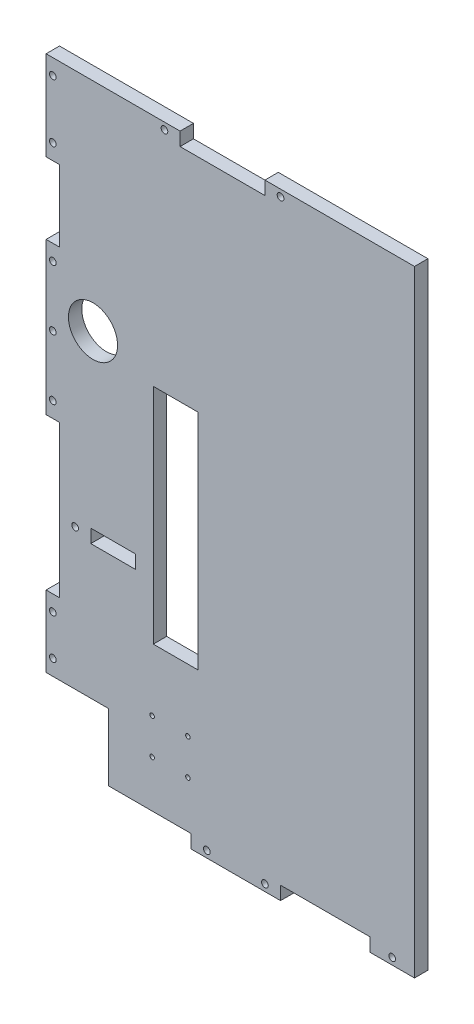
from build123d import *

# Parameters (mm, degrees)
ESQUISSE1_W             = 165
ESQUISSE1_H             = 276
BOSS_EXTRU_1_DEPTH      = 6
ESQUISSE2_W             = 38
ESQUISSE2_H             = 6
ESQUISSE2_W_2           = 6
ESQUISSE2_H_2           = 32
ESQUISSE2_H_3           = 68
ESQUISSE2_W_3           = 40
EXTERIEUR_DEPTH         = 10
ESQUISSE3_R             = 11
ESQUISSE3_W             = 20
ESQUISSE3_H             = 6
ENL_V_MAT_EXTRU_2_DEPTH = 322.616230934
ESQUISSE4_R             = 1.5
ESQUISSE4_R_2           = 1.005
ENL_V_MAT_EXTRU_3_DEPTH = 322.616230934
ESQUISSE5_R             = 2.995
ESQUISSE5_R_2           = 3
ESQUISSE5_R_3           = 2
ENL_V_MAT_EXTRU_4_DEPTH = 3
ESQUISSE6_W             = 20
ESQUISSE6_H             = 100
ENL_V_MAT_EXTRU_5_DEPTH = 322.616230934


with BuildPart() as part:
    # Esquisse1 → Boss.-Extru.1 (new body)
    with BuildSketch(Plane.XY):
        with Locations((-82.5, 138)):
            Rectangle(ESQUISSE1_W, ESQUISSE1_H)
    extrude(amount=BOSS_EXTRU_1_DEPTH)

    # Esquisse2 → exterieur (cut)
    with BuildSketch(Plane.XY.offset(6)):
        with Locations((-86, 273)):
            Rectangle(ESQUISSE2_W, ESQUISSE2_H)
        with Locations((-162, 220)):
            Rectangle(ESQUISSE2_W_2, ESQUISSE2_H_2)
        with Locations((-162, 102)):
            Rectangle(ESQUISSE2_W_2, ESQUISSE2_H_3)
        Polygon((-137, 36), (-137, 6), (-100, 6), (-100, 0), (-165, 0), (-165, 36), align=None)
        with Locations((-40, 3)):
            Rectangle(ESQUISSE2_W_3, ESQUISSE2_H)
    extrude(amount=-EXTERIEUR_DEPTH, mode=Mode.SUBTRACT)

    # Esquisse3 → Enlèv. mat.-Extru.2 (cut, through all)
    with BuildSketch(Plane.XY.offset(6)):
        with Locations((-144, 178.92)):
            Circle(ESQUISSE3_R)
        with Locations((-135, 99)):
            Rectangle(ESQUISSE3_W, ESQUISSE3_H)
    extrude(amount=-ENL_V_MAT_EXTRU_2_DEPTH, mode=Mode.SUBTRACT)

    # Esquisse4 → Enlèv. mat.-Extru.3 (cut, through all)
    with BuildSketch(Plane.XY.offset(6)):
        with Locations((-60, 273)):
            Circle(ESQUISSE4_R)
        with Locations((-112, 273)):
            Circle(ESQUISSE4_R)
        with Locations((-162, 197)):
            Circle(ESQUISSE4_R)
        with Locations((-162, 170)):
            Circle(ESQUISSE4_R)
        with Locations((-162, 143)):
            Circle(ESQUISSE4_R)
        with Locations((-162, 61)):
            Circle(ESQUISSE4_R)
        with Locations((-162, 43)):
            Circle(ESQUISSE4_R)
        with Locations((-93, 3)):
            Circle(ESQUISSE4_R)
        with Locations((-67, 3)):
            Circle(ESQUISSE4_R)
        with Locations((-10, 3)):
            Circle(ESQUISSE4_R)
        with Locations((-162, 269)):
            Circle(ESQUISSE4_R)
        with Locations((-162, 243)):
            Circle(ESQUISSE4_R)
        with Locations((-117.5, 27)):
            Circle(ESQUISSE4_R_2)
        with Locations((-117.5, 43)):
            Circle(ESQUISSE4_R_2)
        with Locations((-101.5, 43)):
            Circle(ESQUISSE4_R_2)
        with Locations((-101.5, 27)):
            Circle(ESQUISSE4_R_2)
        with Locations((-152, 99)):
            Circle(ESQUISSE4_R)
    extrude(amount=-ENL_V_MAT_EXTRU_3_DEPTH, mode=Mode.SUBTRACT)

    # Esquisse5 → Enlèv. mat.-Extru.4 (cut)
    with BuildSketch(Plane(origin=(0, 0, 0), x_dir=(-1, 0, 0), z_dir=(0, 0, -1))):
        with Locations((60, 273)):
            Circle(ESQUISSE5_R)
        with Locations((112, 273)):
            Circle(ESQUISSE5_R)
        with Locations((162, 197)):
            Circle(ESQUISSE5_R)
        with Locations((162, 170)):
            Circle(ESQUISSE5_R)
        with Locations((162, 143)):
            Circle(ESQUISSE5_R)
        with Locations((162, 61)):
            Circle(ESQUISSE5_R)
        with Locations((162, 43)):
            Circle(ESQUISSE5_R)
        with Locations((93, 3)):
            Circle(ESQUISSE5_R)
        with Locations((67, 3)):
            Circle(ESQUISSE5_R)
        with Locations((10, 3)):
            Circle(ESQUISSE5_R)
        with Locations((162, 269)):
            Circle(ESQUISSE5_R)
        with Locations((162, 243)):
            Circle(ESQUISSE5_R)
        with Locations((152, 99)):
            Circle(ESQUISSE5_R_2)
        with Locations((117.5, 43)):
            Circle(ESQUISSE5_R_3)
        with Locations((117.5, 27)):
            Circle(ESQUISSE5_R_3)
        with Locations((101.5, 27)):
            Circle(ESQUISSE5_R_3)
        with Locations((101.5, 43)):
            Circle(ESQUISSE5_R_3)
    extrude(amount=-ENL_V_MAT_EXTRU_4_DEPTH, mode=Mode.SUBTRACT)

    # Esquisse6 → Enlèv. mat.-Extru.5 (cut, through all)
    with BuildSketch(Plane(origin=(0, 0, 0), x_dir=(-1, 0, 0), z_dir=(0, 0, -1))):
        with Locations((107, 121)):
            Rectangle(ESQUISSE6_W, ESQUISSE6_H)
    extrude(amount=-ENL_V_MAT_EXTRU_5_DEPTH, mode=Mode.SUBTRACT)


solid = part.part
